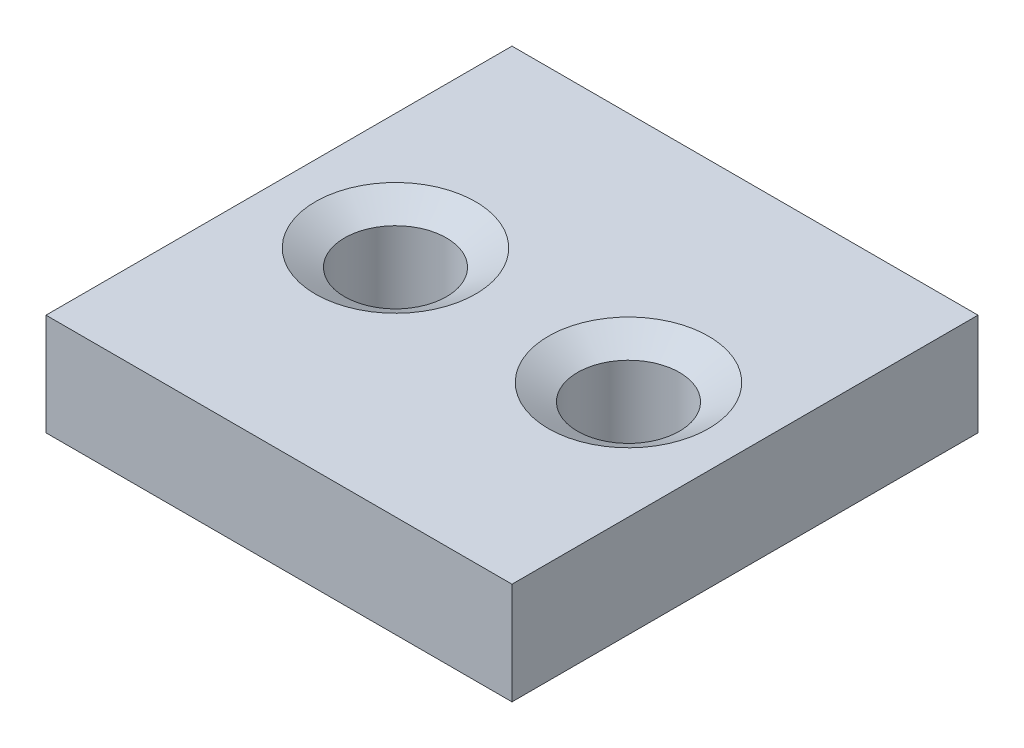
from build123d import *

# Parameters (mm, degrees)
SKETCH1_W           = 32
SKETCH1_H           = 32
SKETCH1_R           = 3.5
BOSS_EXTRUDE1_DEPTH = 7
CHAMFER2_SIZE       = 2
CHAMFER2_SIZE2      = 1.154700538


with BuildPart() as part:
    # Sketch1 → Boss-Extrude1 (new body)
    with BuildSketch(Plane(origin=(0, 0, 0), x_dir=(1, 0, 0), z_dir=(0, 1, 0))):
        Rectangle(SKETCH1_W, SKETCH1_H)
        with Locations(Location((-8, 0, 0), (0, 0, 270))):
            Circle(SKETCH1_R, mode=Mode.SUBTRACT)
        with Locations(Location((8, 0, 0), (0, 0, 270))):
            Circle(SKETCH1_R, mode=Mode.SUBTRACT)
    extrude(amount=BOSS_EXTRUDE1_DEPTH)

    # Chamfer2
    chamfer2_edges = [part.edges().sort_by_distance(p)[0] for p in [
        (-8, 7, -3.5),
        (8, 7, -3.5),
    ]]
    chamfer2_side = [part.faces().sort_by_distance(p)[0] for p in [
        (0, 7, 0),
    ]]
    chamfer(chamfer2_edges, length=CHAMFER2_SIZE, length2=CHAMFER2_SIZE2, reference=chamfer2_side[0])


solid = part.part
